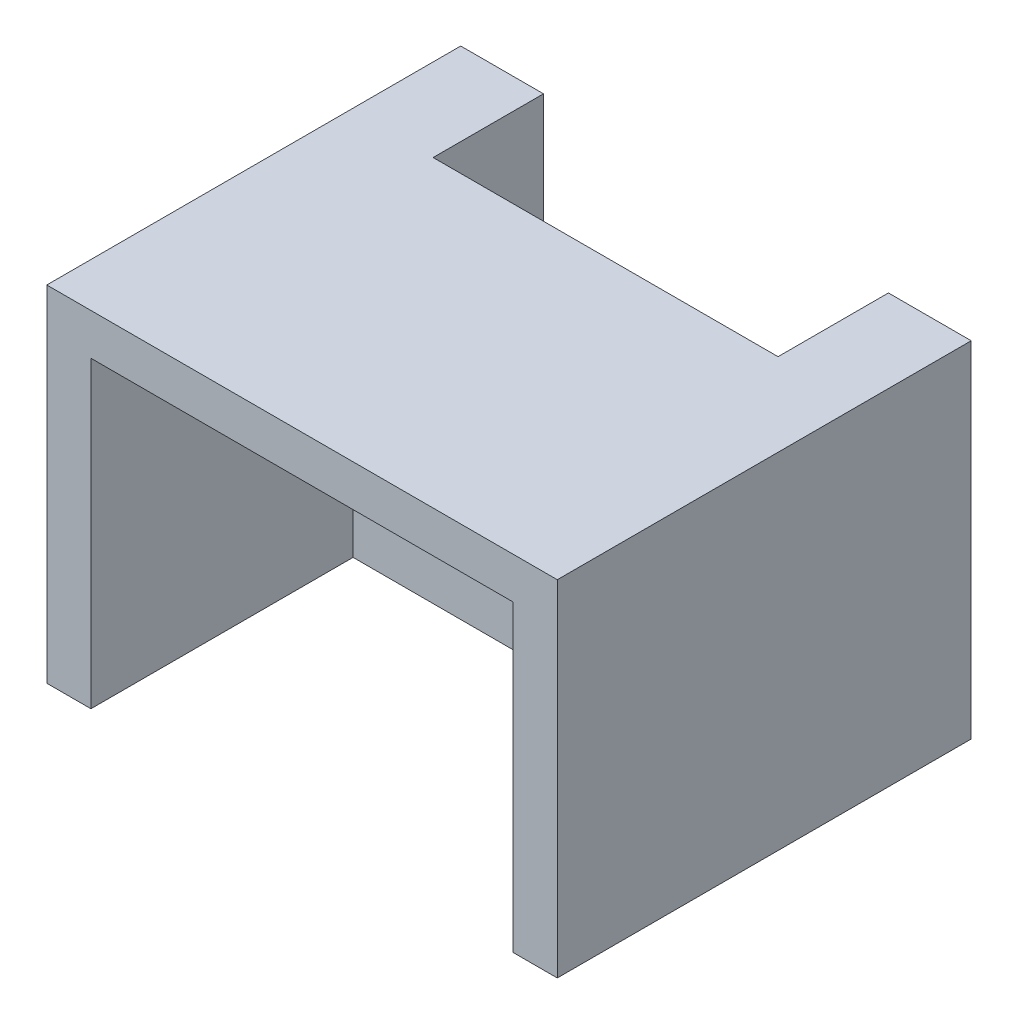
from build123d import *

# Parameters (mm, degrees)
SKETCH1_W           = 25
SKETCH1_H           = 25
BOSS_EXTRUDE1_DEPTH = 37
SKETCH2_W           = 30.6
SKETCH2_H           = 19
CUT_EXTRUDE1_DEPTH  = 22
SKETCH3_W           = 25
SKETCH3_H           = 25
CUT_EXTRUDE2_DEPTH  = 3
SKETCH4_W           = 6
SKETCH4_H           = 25
BOSS_EXTRUDE2_DEPTH = 5
BOSS_EXTRUDE3_DEPTH = 0.8
BOSS_EXTRUDE4_DEPTH = 0.8


with BuildPart() as part:
    # Sketch1 → Boss-Extrude1 (new body)
    with BuildSketch(Plane(origin=(0, 0, 0), x_dir=(0, 0, -1), z_dir=(1, 0, 0))):
        with Locations((12.5, -12.5)):
            Rectangle(SKETCH1_W, SKETCH1_H)
    extrude(amount=BOSS_EXTRUDE1_DEPTH)

    # Sketch2 → Cut-Extrude1 (cut)
    with BuildSketch(Plane.XZ.offset(25)):
        with Locations((18.5, -9.5)):
            Rectangle(SKETCH2_W, SKETCH2_H)
    extrude(amount=-CUT_EXTRUDE1_DEPTH, mode=Mode.SUBTRACT)

    # Sketch3 → Cut-Extrude2 (cut)
    with BuildSketch(Plane(origin=(0, 0, -25), x_dir=(-1, 0, 0), z_dir=(0, 0, -1))):
        with Locations((-18.5, -12.5)):
            Rectangle(SKETCH3_W, SKETCH3_H)
    extrude(amount=-CUT_EXTRUDE2_DEPTH, mode=Mode.SUBTRACT)

    # Sketch4 → Boss-Extrude2 (add)
    with BuildSketch(Plane(origin=(0, 0, -25), x_dir=(-1, 0, 0), z_dir=(0, 0, -1))):
        with Locations((-34, -12.5)):
            Rectangle(SKETCH4_W, SKETCH4_H)
        with Locations((-3, -12.5)):
            Rectangle(SKETCH4_W, SKETCH4_H)
    extrude(amount=BOSS_EXTRUDE2_DEPTH)

    # Sketch5 → Boss-Extrude3 (add)
    with BuildSketch(Plane(origin=(6, 0, 0), x_dir=(0, 0, -1), z_dir=(1, 0, 0))):
        Polygon((30, -15), (27.633974643, -15), (28.5, -23.5), (27.394305398, -23.5), (26.528280041, -15), (22, -15), (22, -25), (30, -25), align=None)
    extrude(amount=BOSS_EXTRUDE3_DEPTH)

    # Sketch6 → Boss-Extrude4 (add)
    with BuildSketch(Plane.ZY.offset(-31)):
        Polygon((-30, -15), (-30, -25), (-22, -25), (-22, -15), (-26.528280041, -15), (-27.394305398, -23.5), (-28.5, -23.5), (-27.633974643, -15), align=None)
    extrude(amount=BOSS_EXTRUDE4_DEPTH)


solid = part.part
